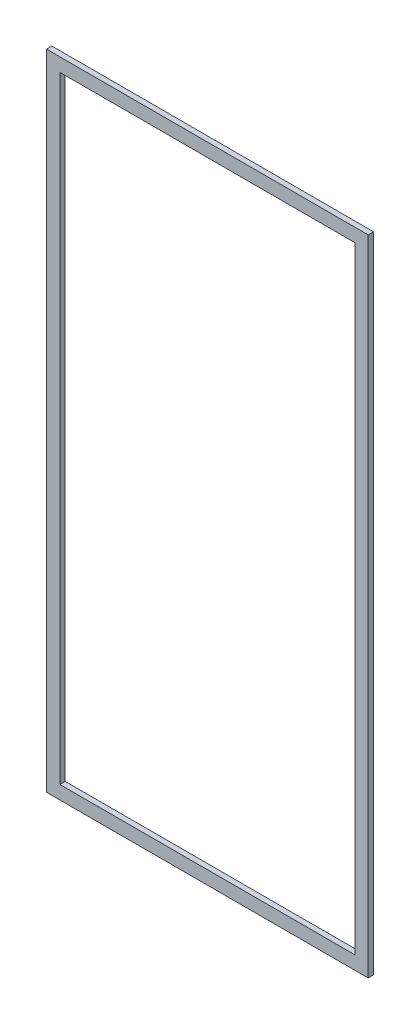
from build123d import *

# Parameters (mm, degrees)
SKETCH1_W           = 600
SKETCH1_H           = 1200
SKETCH1_W_2         = 550
SKETCH1_H_2         = 1150
BOSS_EXTRUDE1_DEPTH = 10


with BuildPart() as part:
    # Sketch1 → Boss-Extrude1 (new body)
    with BuildSketch(Plane.XY):
        Rectangle(SKETCH1_W, SKETCH1_H)
        Rectangle(SKETCH1_W_2, SKETCH1_H_2, mode=Mode.SUBTRACT)
    extrude(amount=BOSS_EXTRUDE1_DEPTH)


solid = part.part
